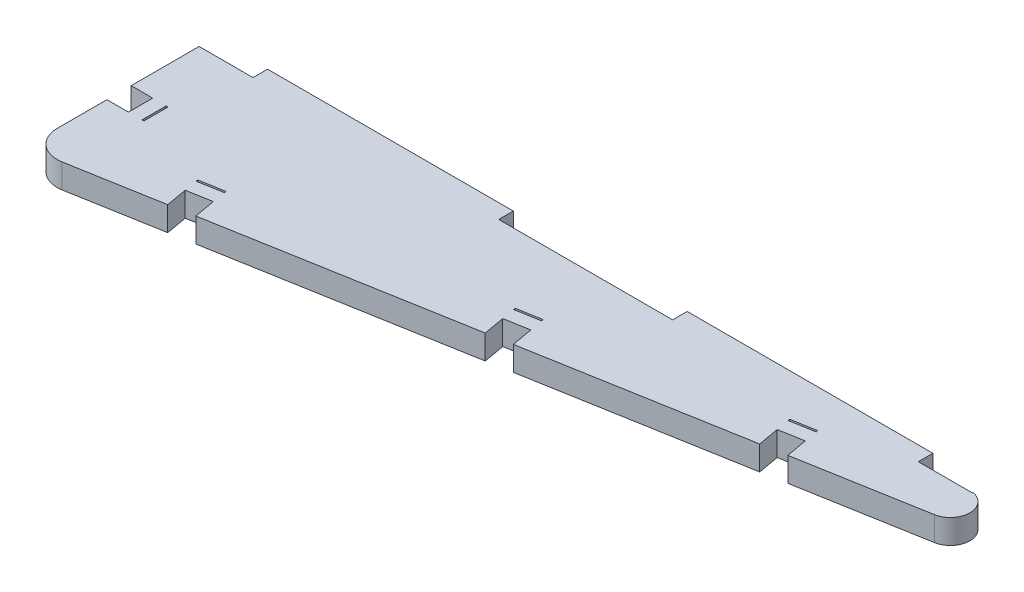
from build123d import *

# Parameters (mm, degrees)
SKETCH1_W           = 0.35
SKETCH1_H           = 4.5
BOSS_EXTRUDE1_DEPTH = 4.5


with BuildPart() as part:
    # Sketch1 → Boss-Extrude1 (new body)
    with BuildSketch(Plane(origin=(0, 0, 0), x_dir=(1, 0, 0), z_dir=(0, 1, 0))):
        with BuildLine():
            Line((-112.624700466, 140.964918284), (-67.062250697, 140.964918284))
            Line((-67.062250697, 140.964918284), (-67.062250697, 138.264918284))
            Line((-67.062250697, 138.264918284), (-34.817903115, 138.264918284))
            Line((-34.817903115, 138.264918284), (-34.817903115, 140.964918284))
            Line((-34.817903115, 140.964918284), (10.744546655, 140.964918284))
            Line((10.744546655, 140.964918284), (10.744546655, 138.264918284))
            Line((10.744546655, 138.264918284), (20.744546655, 138.264918284))
            Line((20.744546655, 138.264918284), (20.744546655, 138.400653035))
            ThreePointArc((20.744546655, 138.400653035), (23.738342853, 134.832785659), (20.744546655, 131.264918284))
            Line((20.744546655, 131.264918284), (-2.381937072, 127.187095234))
            Line((-2.381937072, 127.187095234), (-3.076529782, 131.126326246))
            Line((-3.076529782, 131.126326246), (-7.508164671, 130.344909446))
            Line((-7.508164671, 130.344909446), (-6.81357196, 126.405678434))
            Line((-6.81357196, 126.405678434), (-45.647003133, 119.558296765))
            Line((-45.647003133, 119.558296765), (-46.341595844, 123.497527777))
            Line((-46.341595844, 123.497527777), (-50.773230733, 122.716110978))
            Line((-50.773230733, 122.716110978), (-50.078638022, 118.776879966))
            Line((-50.078638022, 118.776879966), (-95.69726199, 110.733085737))
            Line((-95.69726199, 110.733085737), (-96.3918547, 114.672316749))
            Line((-96.3918547, 114.672316749), (-100.823489589, 113.89089995))
            Line((-100.823489589, 113.89089995), (-100.128896878, 109.951668938))
            Line((-100.128896878, 109.951668938), (-116.756459578, 107.01978101))
            ThreePointArc((-116.756459578, 107.01978101), (-120.838638515, 108.11359756), (-122.624700466, 111.943819775))
            Line((-122.624700466, 111.943819775), (-122.624700466, 121.171097677))
            Line((-122.624700466, 121.171097677), (-118.624700466, 121.171097677))
            Line((-118.624700466, 121.171097677), (-118.624700466, 125.671097677))
            Line((-118.624700466, 125.671097677), (-122.624700466, 125.671097677))
            Line((-122.624700466, 125.671097677), (-122.624700466, 138.264918284))
            Line((-122.624700466, 138.264918284), (-112.624700466, 138.264918284))
            Line((-112.624700466, 138.264918284), (-112.624700466, 140.964918284))
        make_face()
        Polygon((-3.510650226, 133.588345628), (-7.942285115, 132.806928829), (-8.003061977, 133.151611543), (-3.571427089, 133.933028342), align=None, mode=Mode.SUBTRACT)
        Polygon((-46.775716288, 125.95954716), (-51.207351177, 125.17813036), (-51.268128039, 125.522813074), (-46.83649315, 126.304229873), align=None, mode=Mode.SUBTRACT)
        Polygon((-96.791107352, 117.140484264), (-101.257610033, 116.352919332), (-101.318386895, 116.697602046), (-96.851884214, 117.485166978), align=None, mode=Mode.SUBTRACT)
        with Locations((-115.949700466, 123.421097677)):
            Rectangle(SKETCH1_W, SKETCH1_H, mode=Mode.SUBTRACT)
    extrude(amount=BOSS_EXTRUDE1_DEPTH)


solid = part.part
